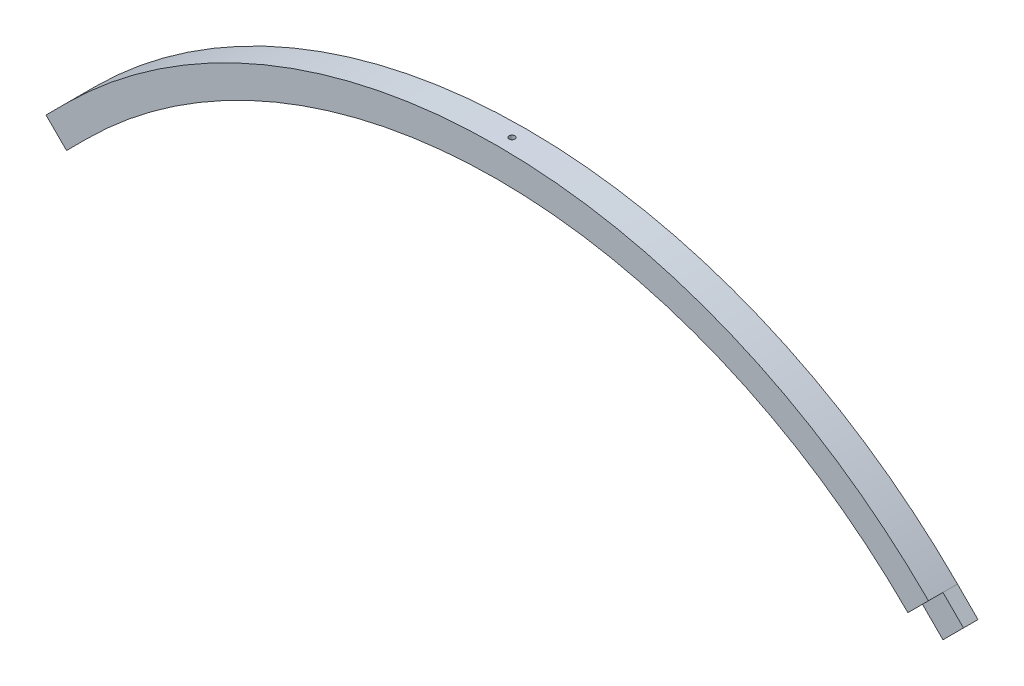
from build123d import *

# Parameters (mm, degrees)
IZIM1_R                     = 210
IZIM1_R_2                   = 200
Y_KSEKLIK_EKSTR_ZYON1_DEPTH = 10
KES_EKSTR_ZYON1_DEPTH       = 290
KES_EKSTR_ZYON1_DEPTH_BACK  = 290
IZIM3_R                     = 1
KES_EKSTR_ZYON2_DEPTH       = 290
KES_EKSTR_ZYON2_DEPTH_BACK  = 290
IZIM4_R                     = 1
KES_EKSTR_ZYON8_DEPTH       = 184
KES_EKSTR_ZYON8_DEPTH_BACK  = 455
IZIM6_W                     = 5
IZIM6_H                     = 10
Y_KSEKLIK_EKSTR_ZYON2_DEPTH = 10
IZIM7_W                     = 5
IZIM7_H                     = 10
Y_KSEKLIK_EKSTR_ZYON4_DEPTH = 10


with BuildPart() as part:
    # Çizim1 → Yükseklik-Ekstrüzyon1 (new body)
    with BuildSketch(Plane.XY):
        Circle(IZIM1_R)
        Circle(IZIM1_R_2, mode=Mode.SUBTRACT)
    extrude(amount=Y_KSEKLIK_EKSTR_ZYON1_DEPTH)

    # Çizim3 → Kes-Ekstrüzyon1 (cut, two sides: drawn at the far end of the back side and taken through both)
    with BuildSketch(Plane(origin=(0, 0, 0), x_dir=(1, 0, 0), z_dir=(0, 1, 0)).offset(-KES_EKSTR_ZYON1_DEPTH_BACK)):
        with Locations((0, -5)):
            Circle(IZIM3_R)
    extrude(amount=KES_EKSTR_ZYON1_DEPTH + KES_EKSTR_ZYON1_DEPTH_BACK, mode=Mode.SUBTRACT)

    # Çizim4 → Kes-Ekstrüzyon2 (cut, two sides: drawn at the far end of the back side and taken through both)
    with BuildSketch(Plane(origin=(0, 0, 0), x_dir=(0, 0, -1), z_dir=(1, 0, 0)).offset(-KES_EKSTR_ZYON2_DEPTH_BACK)):
        with Locations((-5, 0)):
            Circle(IZIM4_R)
    extrude(amount=KES_EKSTR_ZYON2_DEPTH + KES_EKSTR_ZYON2_DEPTH_BACK, mode=Mode.SUBTRACT)

    # Çizim5 → Kes-Ekstrüzyon8 (cut, two sides: drawn at the far end of the back side and taken through both)
    with BuildSketch(Plane.XY.offset(-KES_EKSTR_ZYON8_DEPTH_BACK)):
        with BuildLine():
            Line((-141.421356237, 141.421356237), (-148.492424049, 148.492424049))
            ThreePointArc((-148.492424049, 148.492424049), (0, -210), (148.492424049, 148.492424049))
            Line((148.492424049, 148.492424049), (141.421356237, 141.421356237))
            ThreePointArc((141.421356237, 141.421356237), (0, -200), (-141.421356237, 141.421356237))
        make_face()
    extrude(amount=KES_EKSTR_ZYON8_DEPTH + KES_EKSTR_ZYON8_DEPTH_BACK, mode=Mode.SUBTRACT)

    # Çizim6 → Yükseklik-Ekstrüzyon2 (add)
    with BuildSketch(Plane(origin=(0, 0, 0), x_dir=(0, 0, -1), z_dir=(0.7071067811865477, -0.7071067811865475, 0))):
        with Locations((-2.5, 205)):
            Rectangle(IZIM6_W, IZIM6_H)
    extrude(amount=Y_KSEKLIK_EKSTR_ZYON2_DEPTH)

    # Çizim7 → Yükseklik-Ekstrüzyon4 (add)
    with BuildSketch(Plane(origin=(0, 0, 0), x_dir=(0, 0, 1), z_dir=(-0.7071067811865477, -0.7071067811865475, 0))):
        with Locations((7.5, 205)):
            Rectangle(IZIM7_W, IZIM7_H)
    extrude(amount=Y_KSEKLIK_EKSTR_ZYON4_DEPTH)


solid = part.part
